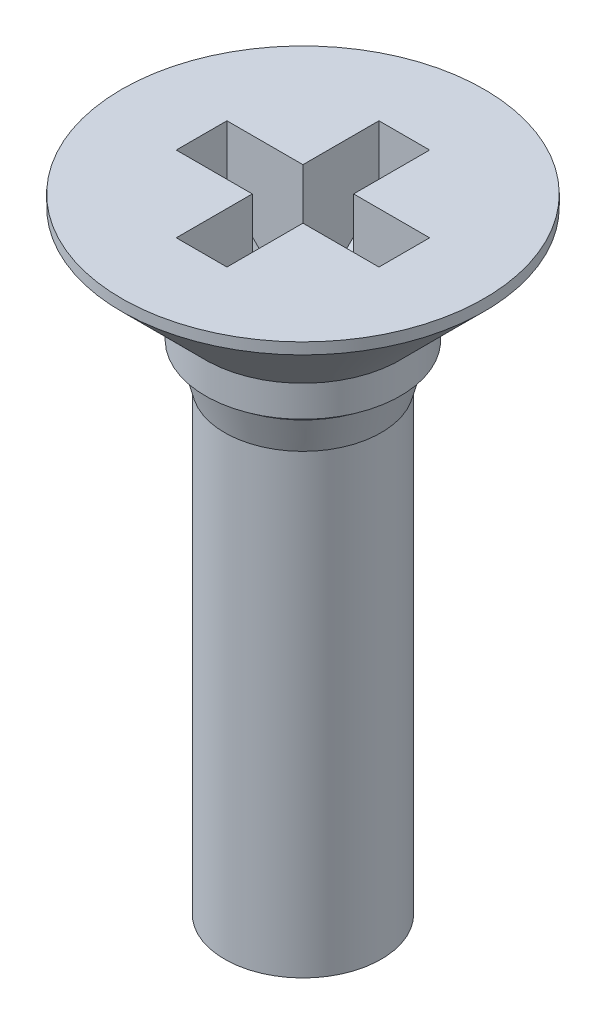
from build123d import *

# Parameters (mm, degrees)
KREUZSCHLITZ1_H_DEPTH      = 0.65
KREUZSCHLITZ1_H_DEPTH_BACK = 0.65
KREUZSCHLITZ2_H_DEPTH      = 0.65
KREUZSCHLITZ2_H_DEPTH_BACK = 0.65


with BuildPart() as part:
    # Skizze1 → Basis-Rotation (revolve)
    with BuildSketch(Plane.XY, mode=Mode.PRIVATE) as basis_rotation_sk:
        Polygon((0, 0), (4.65, 0), (4.65, -0.29), (2.5, -2.44), (2.5, -3.24), (2.24, -3.24), (2.24, -3.439762289), (2.0095, -4.3), (2.0095, -16), (0, -16), align=None)
    revolve(basis_rotation_sk.sketch.rotate(Axis((0, 0, 0), (0, -1, 0)), 180), axis=Axis((0, 0, 0), (0, -1, 0)))

    # Skizze2 → Kreuzschlitz1 H (cut, two sides: drawn at the far end of the back side and taken through both)
    with BuildSketch(Plane.XY.offset(-KREUZSCHLITZ1_H_DEPTH_BACK)):
        Polygon((-1, -3.2), (1, -3.2), (2.6, -1.6), (2.6, 0), (-2.6, 0), (-2.6, -1.6), align=None)
    extrude(amount=KREUZSCHLITZ1_H_DEPTH + KREUZSCHLITZ1_H_DEPTH_BACK, mode=Mode.SUBTRACT)

    # Skizze3 → Kreuzschlitz2 H (cut, two sides: drawn at the far end of the back side and taken through both)
    with BuildSketch(Plane(origin=(0, 0, 0), x_dir=(0, 0, -1), z_dir=(1, 0, 0)).offset(-KREUZSCHLITZ2_H_DEPTH_BACK)):
        Polygon((-1, -3.2), (1, -3.2), (2.6, -1.6), (2.6, 0), (-2.6, 0), (-2.6, -1.6), align=None)
    extrude(amount=KREUZSCHLITZ2_H_DEPTH + KREUZSCHLITZ2_H_DEPTH_BACK, mode=Mode.SUBTRACT)


solid = part.part
